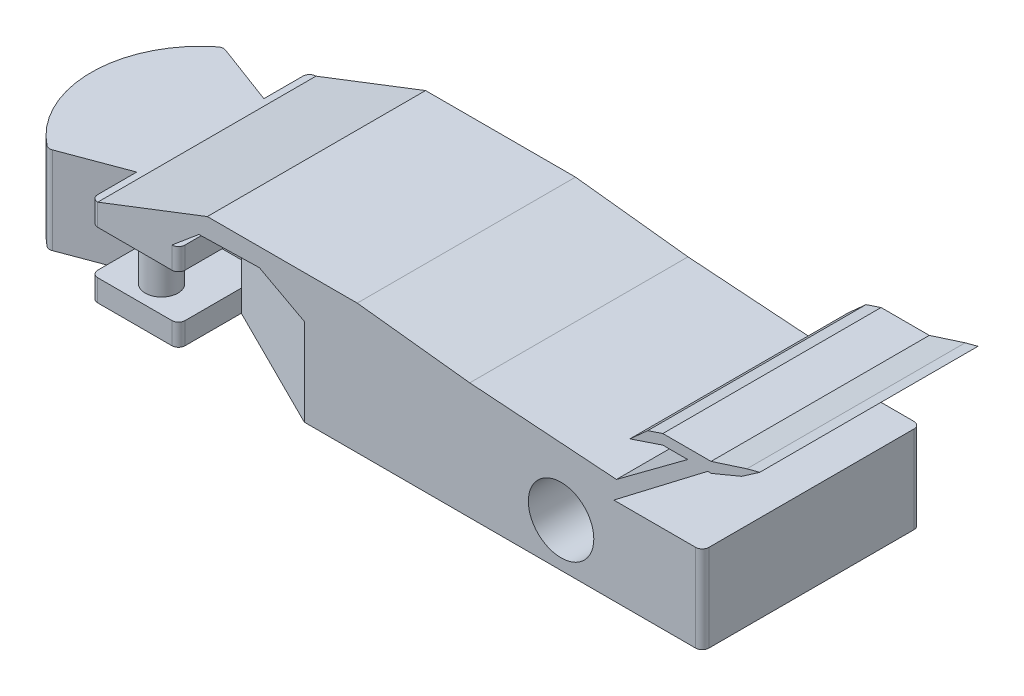
from build123d import *

# Parameters (mm, degrees)
BOSS_EXTRUDE3_DEPTH = 101.6
SKETCH4_R           = 38.1
CUT_EXTRUDE1_DEPTH  = 508
CUT_EXTRUDE2_START  = -25.4
SKETCH16_W          = 101.6
SKETCH16_H          = 101.6
CUT_EXTRUDE2_DEPTH  = 50.8
SKETCH18_R          = 19.05
BOSS_EXTRUDE4_DEPTH = 50.8
CUT_EXTRUDE6_START  = -101.6
CUT_EXTRUDE6_DEPTH  = 101.6
FILLET2_R           = 7.62
BOSS_EXTRUDE7_DEPTH = 254
BOSS_EXTRUDE9_DEPTH = 254
CUT_EXTRUDE11_DEPTH = 50.8
CUT_EXTRUDE12_DEPTH = 50.8


with BuildPart() as part:
    # Sketch1 → Boss-Extrude3 (new body)
    with BuildSketch(Plane(origin=(0, 0, 0), x_dir=(1, 0, 0), z_dir=(0, 1, 0))):
        with BuildLine():
            ThreePointArc((-355.6, 127), (-482.6, 0), (-355.6, -127))
            Line((-355.6, -127), (355.6, -127))
            Line((355.6, -127), (355.6, 127))
            Line((355.6, 127), (-355.6, 127))
        make_face()
    extrude(amount=BOSS_EXTRUDE3_DEPTH)

    # Sketch4 → Cut-Extrude1 (cut)
    with BuildSketch(Plane.XY.offset(127)):
        with Locations((191.262, 50.8)):
            Circle(SKETCH4_R)
    extrude(amount=-CUT_EXTRUDE1_DEPTH, mode=Mode.SUBTRACT)

    # Sketch16 → Cut-Extrude2 (cut)
    with BuildSketch(Plane(origin=(0, 101.6, 0), x_dir=(1, 0, 0), z_dir=(0, 1, 0)).offset(CUT_EXTRUDE2_START)):
        with Locations((-304.8, 76.2)):
            Rectangle(SKETCH16_W, SKETCH16_H)
        with Locations((-304.8, -76.2)):
            Rectangle(SKETCH16_W, SKETCH16_H)
    extrude(amount=-CUT_EXTRUDE2_DEPTH, mode=Mode.SUBTRACT)

    # Sketch18 → Boss-Extrude4 (add)
    with BuildSketch(Plane(origin=(0, 25.4, 0), x_dir=(1, 0, 0), z_dir=(0, 1, 0))):
        with Locations(Location((-304.8, -95.885, 0), (0, 0, 270))):
            Circle(SKETCH18_R)
        with Locations(Location((-304.8, 95.885, 0), (0, 0, 90))):
            Circle(SKETCH18_R)
    extrude(amount=BOSS_EXTRUDE4_DEPTH)

    # Sketch23 → Cut-Extrude6 (cut)
    with BuildSketch(Plane(origin=(0, 101.6, 0), x_dir=(1, 0, 0), z_dir=(0, 1, 0)).offset(CUT_EXTRUDE6_START)):
        with BuildLine():
            Line((-355.6, -127), (-355.6, -73.963969071))
            Line((-355.6, -73.963969071), (-431.029237977, -102.173529146))
            ThreePointArc((-431.029237977, -102.173529146), (-395.304922859, -120.633822375), (-355.6, -127))
        make_face()
        Polygon((-254, -53.893344298), (-254, -127), (-107.585974166, -127), align=None)
        with BuildLine():
            Line((-355.6, 73.963969071), (-431.029237977, 102.173529146))
            ThreePointArc((-431.029237977, 102.173529146), (-395.304922859, 120.633822375), (-355.6, 127))
            Line((-355.6, 127), (-355.6, 73.963969071))
        make_face()
        Polygon((-254, 127), (-107.585974166, 127), (-254, 53.893344298), align=None)
    extrude(amount=CUT_EXTRUDE6_DEPTH, mode=Mode.SUBTRACT)

    # Fillet2
    fillet2_edges = [part.edges().sort_by_distance(p)[0] for p in [
        (-431.029237977, 50.8, -102.173529146),
        (-355.6, 12.7, -127),
        (-355.6, 12.7, 127),
        (-254, 12.7, -127),
        (-254, 88.9, -127),
        (-431.029237977, 50.8, 102.173529146),
        (-254, 88.9, 127),
        (-355.6, 88.9, -127),
        (-254, 12.7, 127),
        (355.6, 50.8, -127),
        (355.6, 50.8, 127),
        (-355.6, 88.9, 127),
    ]]
    fillet(fillet2_edges, radius=FILLET2_R)



with BuildPart() as body_2:
    # Sketch24 → Boss-Extrude7 (new body)
    with BuildSketch(Plane.XY.offset(127)):
        Polygon((362.058648087, 185.307634776), (252.61496451, 101.6), (225.581006965, 101.6), (338.66530168, 185.506014364), (334.087126159, 185.506014364), (309.686436817, 185.506014364), (271.381724032, 172.688112617), (292.121811526, 191.358212215), (309.686436817, 197.210410065), (365.827860262, 197.210410065), (407.553014944, 210.606867151), (422.496366485, 214.52949693), (401.536186127, 199.959729178), (365.827860262, 185.109255188), align=None)
    extrude(amount=-BOSS_EXTRUDE7_DEPTH)


with BuildPart() as part_1:
    add(part.part)

    add(body_2.part)  # Boss-Extrude9 merges body 2
    # Sketch24<8> → Boss-Extrude9 (add)
    with BuildSketch(Plane.XY.offset(127)):
        Polygon((-347.98, 101.6), (225.581006965, 101.6), (255.712540846, 123.956923399), (84.982041767, 135.949988054), (-45.964353963, 150.837955987), (-109.054165893, 150.837955987), (-220.445592276, 150.837955987), align=None)
    extrude(amount=-BOSS_EXTRUDE9_DEPTH)

    # Sketch26 → Cut-Extrude11 (cut)
    with BuildSketch(Plane.XY.offset(127)):
        Polygon((-261.62, 101.6), (-230.279041818, 127.879160506), (-159.925021307, 129.63026439), (-107.585974166, 101.6), align=None)
    extrude(amount=-CUT_EXTRUDE11_DEPTH, mode=Mode.SUBTRACT)

    # Sketch27 → Cut-Extrude12 (cut)
    with BuildSketch(Plane(origin=(0, 0, -127), x_dir=(-1, 0, 0), z_dir=(0, 0, -1))):
        Polygon((107.606718178, 101.590603269), (138.94767636, 127.869763774), (209.301696871, 129.620867658), (261.640744012, 101.590603269), align=None)
    extrude(amount=-CUT_EXTRUDE12_DEPTH, mode=Mode.SUBTRACT)


solid = part_1.part
